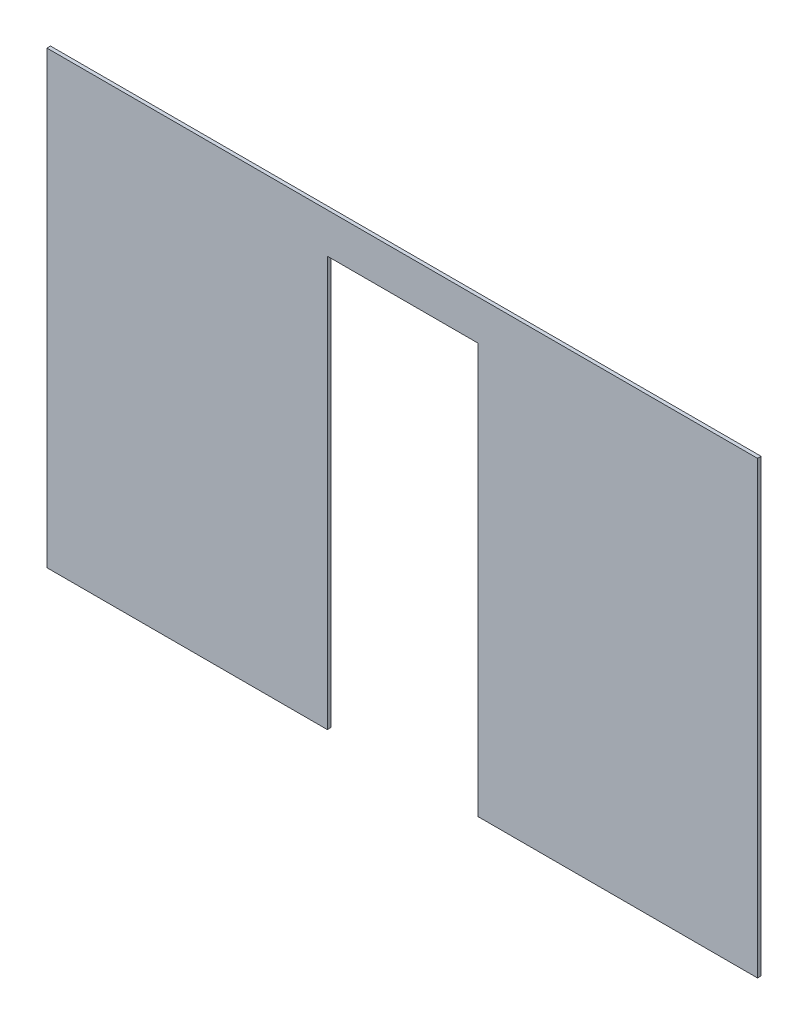
from build123d import *

# Parameters (mm, degrees)
CROQUIS1_W              = 600
CROQUIS1_H              = 380
SALIENTE_EXTRUIR1_DEPTH = 3
CROQUIS2_W              = 127.358400795
CROQUIS2_H              = 346.213758298
CORTAR_EXTRUIR1_DEPTH   = 10


with BuildPart() as part:
    # Croquis1 → Saliente-Extruir1 (new body)
    with BuildSketch(Plane.XY):
        Rectangle(CROQUIS1_W, CROQUIS1_H)
    extrude(amount=SALIENTE_EXTRUIR1_DEPTH)

    # Croquis2 → Cortar-Extruir1 (cut)
    with BuildSketch(Plane(origin=(0, 0, 0), x_dir=(-1, 0, 0), z_dir=(0, 0, -1))):
        with Locations((-0.414048453, -16.893120851)):
            Rectangle(CROQUIS2_W, CROQUIS2_H)
    extrude(amount=-CORTAR_EXTRUIR1_DEPTH, mode=Mode.SUBTRACT)


solid = part.part
